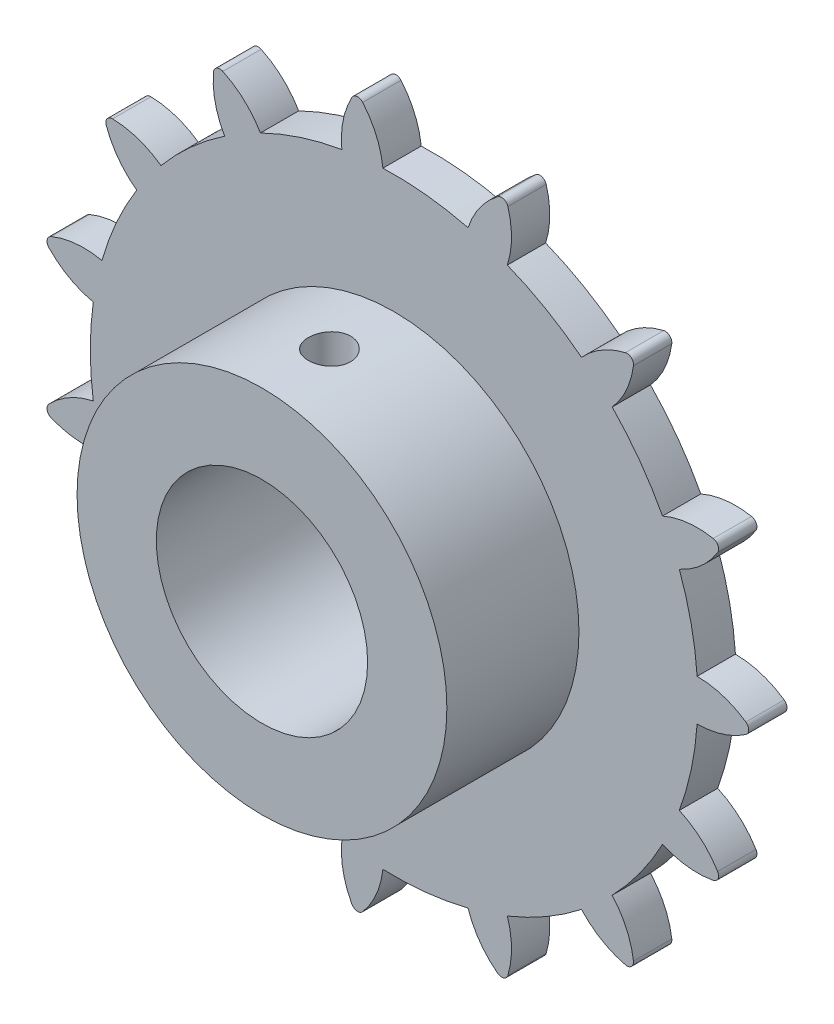
from build123d import *

# Parameters (mm, degrees)
SKETCH1_R                 = 11.5
BOSS_EXTRUDE1_DEPTH       = 1.45
BOSS_EXTRUDE2_DEPTH       = 1.45
CIRPATTERN2_COUNT         = 15
SKETCH4_R                 = 4
CUT_EXTRUDE1_DEPTH        = 1.45
BOSS_EXTRUDE3_START       = 5
SKETCH5_R                 = 7
SKETCH5_R_2               = 4
BOSS_EXTRUDE3_DEPTH       = 5
M2X0_4_TAPPED_HOLE3_D     = 1.6
M2X0_4_TAPPED_HOLE3_DEPTH = 5.2
M2X0_4_TAPPED_HOLE3_TIP   = 0.480688495


with BuildPart() as part:
    # Sketch1 → Boss-Extrude1 (new body)
    with BuildSketch(Plane.XY):
        Circle(SKETCH1_R)
    extrude(amount=BOSS_EXTRUDE1_DEPTH)

    # Sketch2 → Boss-Extrude2 (add)
    with BuildSketch(Plane.XY.offset(1.45)):
        with BuildLine():
            Line((11.466388324, -0.781762992), (11.466388324, 0.781762992))
            ThreePointArc((11.466388324, 0.781762992), (12.435767446, 0.634469665), (13.317644229, 0.205885315))
            ThreePointArc((13.317644229, 0.205885315), (13.425830137, 0), (13.317644229, -0.205885315))
            ThreePointArc((13.317644229, -0.205885315), (12.435767446, -0.634469665), (11.466388324, -0.781762992))
        make_face()
    boss_extrude2 = extrude(amount=-BOSS_EXTRUDE2_DEPTH)

    # CirPattern2: Boss-Extrude2 ×15 about axis
    cirpattern2_axis = Axis((0, 0, 0), (0, 0, 1))
    for i in range(1, CIRPATTERN2_COUNT):
        add(boss_extrude2.rotate(cirpattern2_axis, i * 360 / CIRPATTERN2_COUNT))

    # Sketch4 → Cut-Extrude1 (cut)
    with BuildSketch(Plane.XY.offset(1.45)):
        Circle(SKETCH4_R)
    extrude(amount=-CUT_EXTRUDE1_DEPTH, mode=Mode.SUBTRACT)

    # Sketch5 → Boss-Extrude3 (add)
    with BuildSketch(Plane.XY.offset(1.45).offset(BOSS_EXTRUDE3_START)):
        Circle(SKETCH5_R)
        Circle(SKETCH5_R_2, mode=Mode.SUBTRACT)
    extrude(amount=-BOSS_EXTRUDE3_DEPTH)

    # M2x0.4 Tapped Hole3
    with Locations(Plane(origin=(-0.021974878, 6.999965507, 3.87491846), x_dir=(0.999995072485, 0.003139268242, 0), z_dir=(-0.003139268242, 0.999995072485, 0))):
        with Locations((0, 0)):
            Hole(M2X0_4_TAPPED_HOLE3_D / 2, depth=M2X0_4_TAPPED_HOLE3_DEPTH)
            with Locations((0, 0, -(M2X0_4_TAPPED_HOLE3_DEPTH + M2X0_4_TAPPED_HOLE3_TIP / 2))):  # 118° drill point
                Cone(0, M2X0_4_TAPPED_HOLE3_D / 2, M2X0_4_TAPPED_HOLE3_TIP, mode=Mode.SUBTRACT)


solid = part.part
